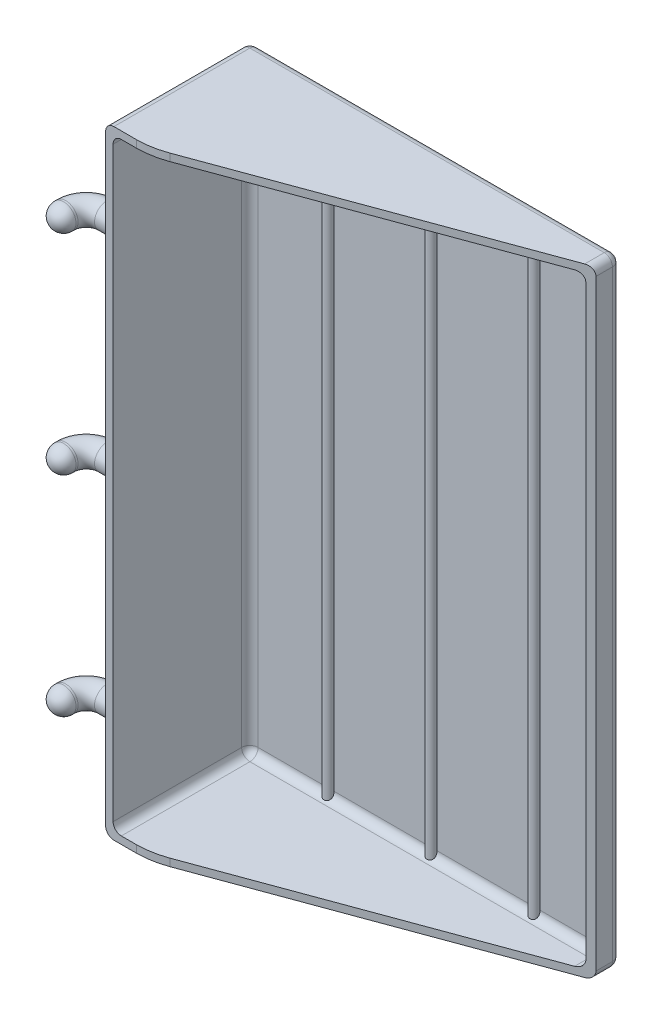
from build123d import *

# Parameters (mm, degrees)
SKETCH1_W                       = 150
SKETCH1_H                       = 90
BOSS_EXTRUDE1_DEPTH             = 1.8
SKETCH2_W                       = 90
SKETCH2_H                       = 150
SKETCH2_W_2                     = 86.4
SKETCH2_H_2                     = 146.4
BOSS_EXTRUDE3_DEPTH             = 33.2
CUT_EXTRUDE1_REACH              = 162.468
SWEEP2_PROFILE_R                = 3
SWEEP3_PROFILE_R                = 3
FILLET2_R                       = 3
LPATTERN1_COUNT                 = 2
LPATTERN1_PITCH                 = 50.8
FILLET2_OF_LPATTERN1_R          = 3
LPATTERN1_COL_COUNT             = 2
LPATTERN1_COL_PITCH             = 50.8
FILLET2_OF_LPATTERN1_COL_R      = 3
FILLET3_R                       = 2
FILLET4_R                       = 20
BOSS_EXTRUDE4_REACH             = 104.122
BOSS_EXTRUDE4_DIRECTION_2_REACH = 104.122


with BuildPart() as part:
    # Sketch1 → Boss-Extrude1 (new body)
    with BuildSketch(Plane(origin=(0, 0, 0), x_dir=(0, 1, 0), z_dir=(0, 0, 1))):
        Rectangle(SKETCH1_W, SKETCH1_H)
    extrude(amount=BOSS_EXTRUDE1_DEPTH)

    # Sketch2 → Boss-Extrude3 (add)
    with BuildSketch(Plane.XY.offset(1.8)):
        Rectangle(SKETCH2_W, SKETCH2_H)
        Rectangle(SKETCH2_W_2, SKETCH2_H_2, mode=Mode.SUBTRACT)
    extrude(amount=BOSS_EXTRUDE3_DEPTH)

    # Cut-Extrude1: up to this face of the body (flat: up to its plane)
    cut_extrude1_end = Plane(part.part.faces().sort_by_distance((0, 75, 17.5))[0])
    # Sketch3 → Cut-Extrude1 (cut, up to the picked face)
    with BuildSketch(Plane.XZ.offset(75), mode=Mode.PRIVATE) as cut_extrude1_sk1:
        Polygon((-34, 35), (45, 6), (45, 35), align=None)
    cut_extrude1_tool1 = split(extrude(cut_extrude1_sk1.sketch, amount=-CUT_EXTRUDE1_REACH, mode=Mode.PRIVATE), bisect_by=cut_extrude1_end, keep=Keep.BOTH, mode=Mode.PRIVATE)
    add(cut_extrude1_tool1.solids().sort_by(Axis((18.666667, -75, 25.333333), (0, 1, 0)))[0], mode=Mode.SUBTRACT)

    # Sweep2: sweep along a path in Sketch5
    with BuildLine(Plane(origin=(0, 0, 0), x_dir=(-1, 0, 0), z_dir=(0, 1, 0))) as sweep2_path:
        Line((45, 30.2), (49.5, 30.2))
        ThreePointArc((49.5, 30.2), (53.035533906, 31.664466094), (54.5, 35.2))
        Line((54.5, 35.2), (54.5, 38.7))
    # Sweep2 profile (on start of the path) → Sweep2 (sweep)
    with BuildSketch(Plane(origin=(-45, 0, 30.2), x_dir=(0, 0, -1), z_dir=(-1, 0, 0))):
        Circle(SWEEP2_PROFILE_R)
    sweep2 = sweep(path=sweep2_path.line)

    # Sweep3: sweep along a path in Sketch18
    with BuildLine(Plane(origin=(0, 0, 0), x_dir=(-1, 0, 0), z_dir=(0, 1, 0))) as sweep3_path:
        Line((45, 4.8), (55, 4.8))
    # Sweep3 profile (on start of the path) → Sweep3 (sweep)
    with BuildSketch(Plane(origin=(-45, 0, 4.8), x_dir=(0, 0, -1), z_dir=(-1, 0, 0))):
        Circle(SWEEP3_PROFILE_R)
    sweep3 = sweep(path=sweep3_path.line)

    # Fillet2
    fillet2_edges = [part.edges().sort_by_distance(p)[0] for p in [
        (-51.5, 0, 38.7),
        (-55, 0, 7.8),
    ]]
    fillet(fillet2_edges, radius=FILLET2_R)

    # LPattern1: Sweep2, Sweep3 ×2
    with Locations(*[(0, -i * LPATTERN1_PITCH, 0) for i in range(1, LPATTERN1_COUNT)]):
        add(sweep2)
        add(sweep3)

    # Fillet2 of LPattern1
    fillet2_of_lpattern1_edges = [part.edges().sort_by_distance(p)[0] for p in [
        (-51.5, -50.8, 38.7),
        (-55, -50.8, 7.8),
    ]]
    fillet(fillet2_of_lpattern1_edges, radius=FILLET2_OF_LPATTERN1_R)

    # LPattern1 col: Sweep2, Sweep3 ×2
    with Locations(*[(0, i * LPATTERN1_COL_PITCH, 0) for i in range(1, LPATTERN1_COL_COUNT)]):
        add(sweep2)
        add(sweep3)

    # Fillet2 of LPattern1 col
    fillet2_of_lpattern1_col_edges = [part.edges().sort_by_distance(p)[0] for p in [
        (-51.5, 50.8, 38.7),
        (-55, 50.8, 7.8),
    ]]
    fillet(fillet2_of_lpattern1_col_edges, radius=FILLET2_OF_LPATTERN1_COL_R)

    # Fillet3
    fillet3_edges = [part.edges().sort_by_distance(p)[0] for p in [
        (43.2, 0, 1.8),
        (0, 73.2, 1.8),
        (-43.2, 0, 1.8),
        (0, -73.2, 1.8),
        (-43.2, 73.2, 18.4),
        (-43.2, -73.2, 18.4),
        (43.2, -73.2, 4.230379747),
        (43.2, 73.2, 4.230379747),
        (45, 75, 3),
        (45, -75, 3),
        (45, 0, 0),
        (0, -75, 0),
        (-45, 0, 0),
        (0, 75, 0),
        (-45, -75, 17.5),
        (-45, 75, 17.5),
    ]]
    fillet(fillet3_edges, radius=FILLET3_R)

    # Fillet4
    fillet4_edges = [part.edges().sort_by_distance(p)[0] for p in [
        (-34, -74.1, 35),
        (-34, 74.1, 35),
    ]]
    fillet(fillet4_edges, radius=FILLET4_R)

    # Sketch66 → Boss-Extrude4 (add, up to next)
    with BuildSketch(Plane(origin=(0, 0, 0), x_dir=(-1, 0, 0), z_dir=(0, 1, 0)), mode=Mode.PRIVATE) as boss_extrude4_sk1:
        with BuildLine():
            Line((-27.25, 1.8), (-24.75, 1.8))
            ThreePointArc((-24.75, 1.8), (-26, 3), (-27.25, 1.8))
        make_face()
    boss_extrude4_tool1 = extrude(boss_extrude4_sk1.sketch, amount=BOSS_EXTRUDE4_REACH, mode=Mode.PRIVATE) - part.part
    # Sketch66 → Boss-Extrude4 (add, up to next)
    with BuildSketch(Plane(origin=(0, 0, 0), x_dir=(-1, 0, 0), z_dir=(0, 1, 0)), mode=Mode.PRIVATE) as boss_extrude4_sk2:
        with BuildLine():
            Line((-2.25, 1.8), (0.25, 1.8))
            ThreePointArc((0.25, 1.8), (-1, 3), (-2.25, 1.8))
        make_face()
    boss_extrude4_tool2 = extrude(boss_extrude4_sk2.sketch, amount=BOSS_EXTRUDE4_REACH, mode=Mode.PRIVATE) - part.part
    # Sketch66 → Boss-Extrude4 (add, up to next)
    with BuildSketch(Plane(origin=(0, 0, 0), x_dir=(-1, 0, 0), z_dir=(0, 1, 0)), mode=Mode.PRIVATE) as boss_extrude4_sk3:
        with BuildLine():
            Line((22.75, 1.8), (25.25, 1.8))
            ThreePointArc((25.25, 1.8), (24, 3), (22.75, 1.8))
        make_face()
    boss_extrude4_tool3 = extrude(boss_extrude4_sk3.sketch, amount=BOSS_EXTRUDE4_REACH, mode=Mode.PRIVATE) - part.part
    add(boss_extrude4_tool1.solids().sort_by_distance((26, 0, 2.307604))[0])
    add(boss_extrude4_tool2.solids().sort_by_distance((1, 0, 2.307604))[0])
    add(boss_extrude4_tool3.solids().sort_by_distance((-24, 0, 2.307604))[0])

    # Sketch66 → Boss-Extrude4 direction 2 (add, up to next)
    with BuildSketch(Plane(origin=(0, 0, 0), x_dir=(-1, 0, 0), z_dir=(0, 1, 0)), mode=Mode.PRIVATE) as boss_extrude4_direction_2_sk1:
        with BuildLine():
            Line((-27.25, 1.8), (-24.75, 1.8))
            ThreePointArc((-24.75, 1.8), (-26, 3), (-27.25, 1.8))
        make_face()
    boss_extrude4_direction_2_tool1 = extrude(boss_extrude4_direction_2_sk1.sketch, amount=-BOSS_EXTRUDE4_DIRECTION_2_REACH, mode=Mode.PRIVATE) - part.part
    # Sketch66 → Boss-Extrude4 direction 2 (add, up to next)
    with BuildSketch(Plane(origin=(0, 0, 0), x_dir=(-1, 0, 0), z_dir=(0, 1, 0)), mode=Mode.PRIVATE) as boss_extrude4_direction_2_sk2:
        with BuildLine():
            Line((-2.25, 1.8), (0.25, 1.8))
            ThreePointArc((0.25, 1.8), (-1, 3), (-2.25, 1.8))
        make_face()
    boss_extrude4_direction_2_tool2 = extrude(boss_extrude4_direction_2_sk2.sketch, amount=-BOSS_EXTRUDE4_DIRECTION_2_REACH, mode=Mode.PRIVATE) - part.part
    # Sketch66 → Boss-Extrude4 direction 2 (add, up to next)
    with BuildSketch(Plane(origin=(0, 0, 0), x_dir=(-1, 0, 0), z_dir=(0, 1, 0)), mode=Mode.PRIVATE) as boss_extrude4_direction_2_sk3:
        with BuildLine():
            Line((22.75, 1.8), (25.25, 1.8))
            ThreePointArc((25.25, 1.8), (24, 3), (22.75, 1.8))
        make_face()
    boss_extrude4_direction_2_tool3 = extrude(boss_extrude4_direction_2_sk3.sketch, amount=-BOSS_EXTRUDE4_DIRECTION_2_REACH, mode=Mode.PRIVATE) - part.part
    add(boss_extrude4_direction_2_tool1.solids().sort_by_distance((26, 0, 2.307604))[0])
    add(boss_extrude4_direction_2_tool2.solids().sort_by_distance((1, 0, 2.307604))[0])
    add(boss_extrude4_direction_2_tool3.solids().sort_by_distance((-24, 0, 2.307604))[0])


solid = part.part
